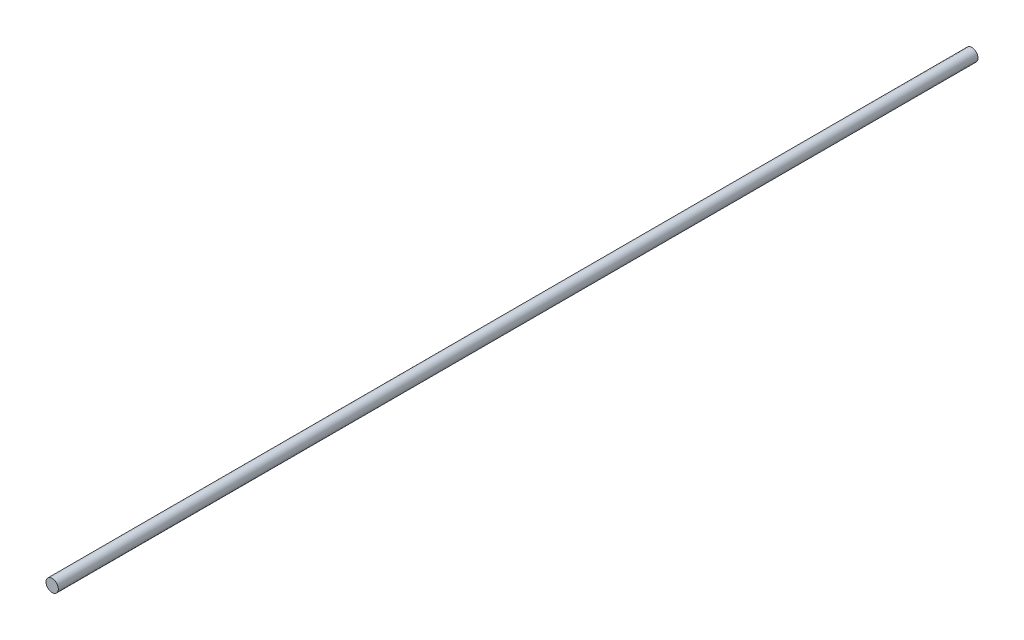
from build123d import *

# Parameters (mm, degrees)
SKETCH1_R           = 2.38125
BOSS_EXTRUDE1_DEPTH = 177.8


with BuildPart() as part:
    # Sketch1 → Boss-Extrude1 (new, symmetric)
    with BuildSketch(Plane.XY):
        Circle(SKETCH1_R)
    extrude(amount=BOSS_EXTRUDE1_DEPTH, both=True)


solid = part.part
